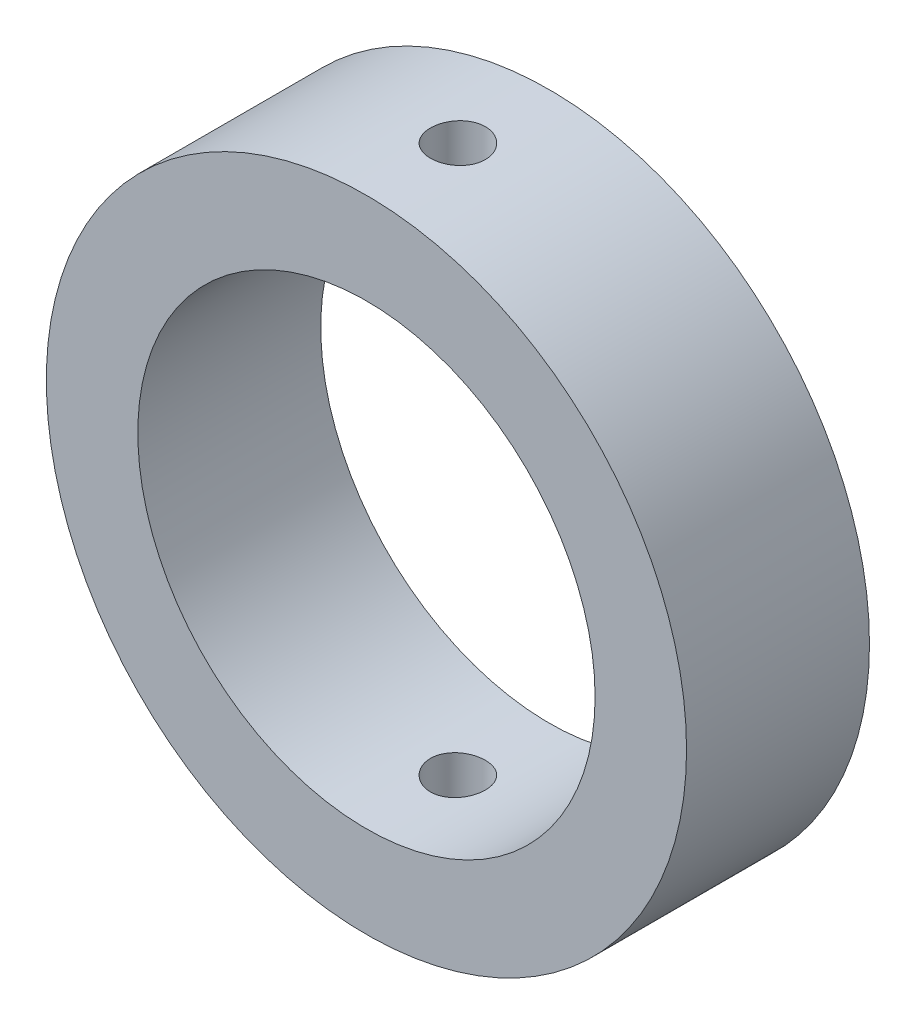
from build123d import *

# Parameters (mm, degrees)
SKETCH2_R               = 35
SKETCH2_R_2             = 25
BOSS_EXTRUDE1_DEPTH     = 20
CUT_EXTRUDE1_DEPTH      = 54.38539126
CUT_EXTRUDE1_DEPTH_BACK = 54.38539126
SKETCH3_R               = 3


with BuildPart() as part:
    # Sketch2 → Boss-Extrude1 (new body)
    with BuildSketch(Plane.XY):
        Circle(SKETCH2_R)
        Circle(SKETCH2_R_2, mode=Mode.SUBTRACT)
    extrude(amount=BOSS_EXTRUDE1_DEPTH)

    # Sketch3 → Cut-Extrude1 (cut, two sides: drawn at the far end of the back side and taken through both)
    with BuildSketch(Plane(origin=(0, 0, 0), x_dir=(1, 0, 0), z_dir=(0, 1, 0)).offset(-CUT_EXTRUDE1_DEPTH_BACK)):
        with Locations(Location((0, -10, 0), (0, 0, 270))):
            Circle(SKETCH3_R)
    extrude(amount=CUT_EXTRUDE1_DEPTH + CUT_EXTRUDE1_DEPTH_BACK, mode=Mode.SUBTRACT)


solid = part.part
